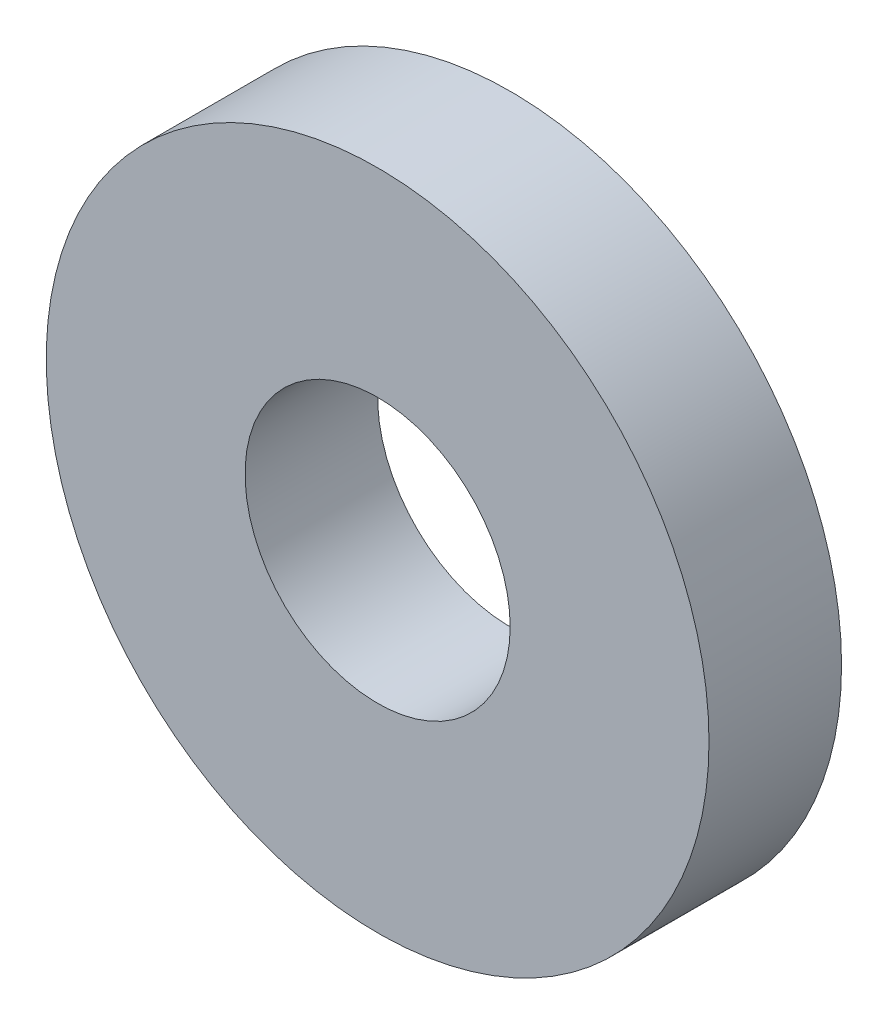
from build123d import *

# Parameters (mm, degrees)
SKETCH1_R           = 25
SKETCH1_R_2         = 10
BOSS_EXTRUDE1_DEPTH = 10


with BuildPart() as part:
    # Sketch1 → Boss-Extrude1 (new body)
    with BuildSketch(Plane.XY):
        Circle(SKETCH1_R)
        Circle(SKETCH1_R_2, mode=Mode.SUBTRACT)
    extrude(amount=BOSS_EXTRUDE1_DEPTH)


solid = part.part
